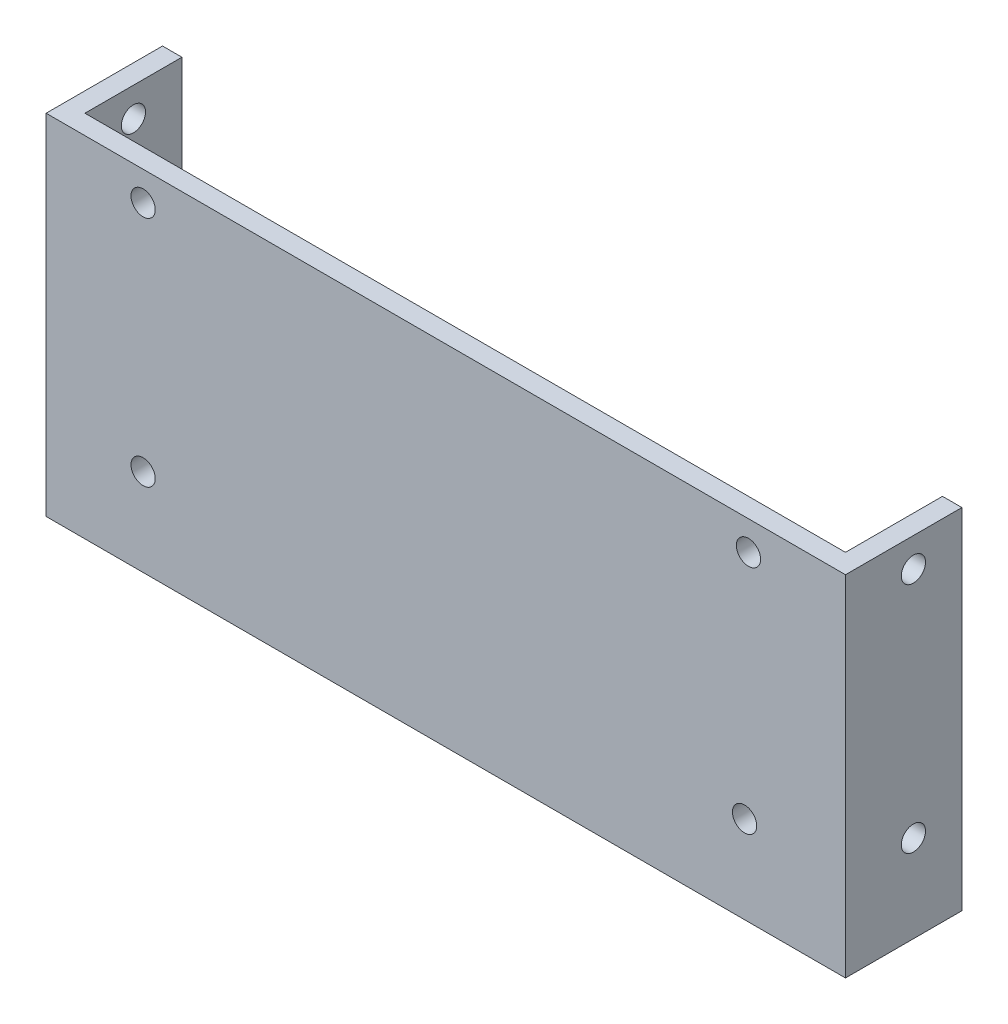
from build123d import *

# Parameters (mm, degrees)
SKETCH_1_W               = 82.4
SKETCH_1_H               = 6
EXTRUDE_1_DEPTH          = 2
SKETCH_2_W               = 2
SKETCH_2_H               = 6
EXTRUDE_2_DEPTH          = 10
CUT_EXTRUDE_1_REACH      = 85.485
SKETCH_3_R               = 1.25
CUT_EXTRUDE_2_DEPTH      = 84.221151158
CUT_EXTRUDE_2_DEPTH_BACK = 84.221151158
SKETCH_4_R               = 1.25
EXTRUDE_3_DEPTH          = 30
CUT_EXTRUDE_3_DEPTH      = 87.395370246
CUT_EXTRUDE_3_DEPTH_BACK = 87.395370246
SKETCH_9_R               = 1.25
SKETCH_10_R              = 1.25
CUT_EXTRUDE_4_DEPTH      = 89.25961704


with BuildPart() as part:
    # 草图1 → 凸台-拉伸1 (new body)
    with BuildSketch(Plane.XY):
        with Locations((41.2, 3)):
            Rectangle(SKETCH_1_W, SKETCH_1_H)
    extrude(amount=EXTRUDE_1_DEPTH)

    # 草图2 → 凸台-拉伸2 (add)
    with BuildSketch(Plane(origin=(0, 0, 0), x_dir=(-1, 0, 0), z_dir=(0, 0, -1))):
        with Locations((-1, 3)):
            Rectangle(SKETCH_2_W, SKETCH_2_H)
        with Locations((-81.4, 3)):
            Rectangle(SKETCH_2_W, SKETCH_2_H)
    extrude(amount=EXTRUDE_2_DEPTH)

    # 草图3 → 切除-拉伸1 (cut, up to next)
    with BuildSketch(Plane.XY.offset(2), mode=Mode.PRIVATE) as cut_extrude_1_sk1:
        with Locations((10, 3)):
            Circle(SKETCH_3_R)
    cut_extrude_1_tool1 = extrude(cut_extrude_1_sk1.sketch, amount=-CUT_EXTRUDE_1_REACH, mode=Mode.PRIVATE) & part.part
    # 草图3 → 切除-拉伸1 (cut, up to next)
    with BuildSketch(Plane.XY.offset(2), mode=Mode.PRIVATE) as cut_extrude_1_sk2:
        with Locations((72.4, 3)):
            Circle(SKETCH_3_R)
    cut_extrude_1_tool2 = extrude(cut_extrude_1_sk2.sketch, amount=-CUT_EXTRUDE_1_REACH, mode=Mode.PRIVATE) & part.part
    add(cut_extrude_1_tool1.solids().sort_by_distance((10, 3, 2))[0], mode=Mode.SUBTRACT)
    add(cut_extrude_1_tool2.solids().sort_by_distance((72.4, 3, 2))[0], mode=Mode.SUBTRACT)

    # 草图4 → 切除-拉伸2 (cut, two sides: drawn at the far end of the back side and taken through both)
    with BuildSketch(Plane(origin=(82.4, 0, 0), x_dir=(0, 0, -1), z_dir=(1, 0, 0)).offset(-CUT_EXTRUDE_2_DEPTH_BACK)):
        with Locations((5, 3)):
            Circle(SKETCH_4_R)
    extrude(amount=CUT_EXTRUDE_2_DEPTH + CUT_EXTRUDE_2_DEPTH_BACK, mode=Mode.SUBTRACT)

    # 草图5 → 凸台-拉伸3 (add)
    with BuildSketch(Plane.XZ):
        Polygon((0, 2), (0, -10), (2, -10), (2, 0), (80.4, 0), (80.4, -10), (82.4, -10), (82.4, 2), align=None)
    extrude(amount=EXTRUDE_3_DEPTH)

    # 草图9 → 切除-拉伸3 (cut, two sides: drawn at the far end of the back side and taken through both)
    with BuildSketch(Plane.ZY.offset(-80.4).offset(-CUT_EXTRUDE_3_DEPTH_BACK)):
        with Locations((-5, -21)):
            Circle(SKETCH_9_R)
    extrude(amount=CUT_EXTRUDE_3_DEPTH + CUT_EXTRUDE_3_DEPTH_BACK, mode=Mode.SUBTRACT)

    # 草图10 → 切除-拉伸4 (cut, through all)
    with BuildSketch(Plane(origin=(0, 0, 0), x_dir=(-1, 0, 0), z_dir=(0, 0, -1))):
        with Locations((-10, -21)):
            Circle(SKETCH_10_R)
        with Locations((-72, -21)):
            Circle(SKETCH_10_R)
    extrude(amount=-CUT_EXTRUDE_4_DEPTH, mode=Mode.SUBTRACT)


solid = part.part
